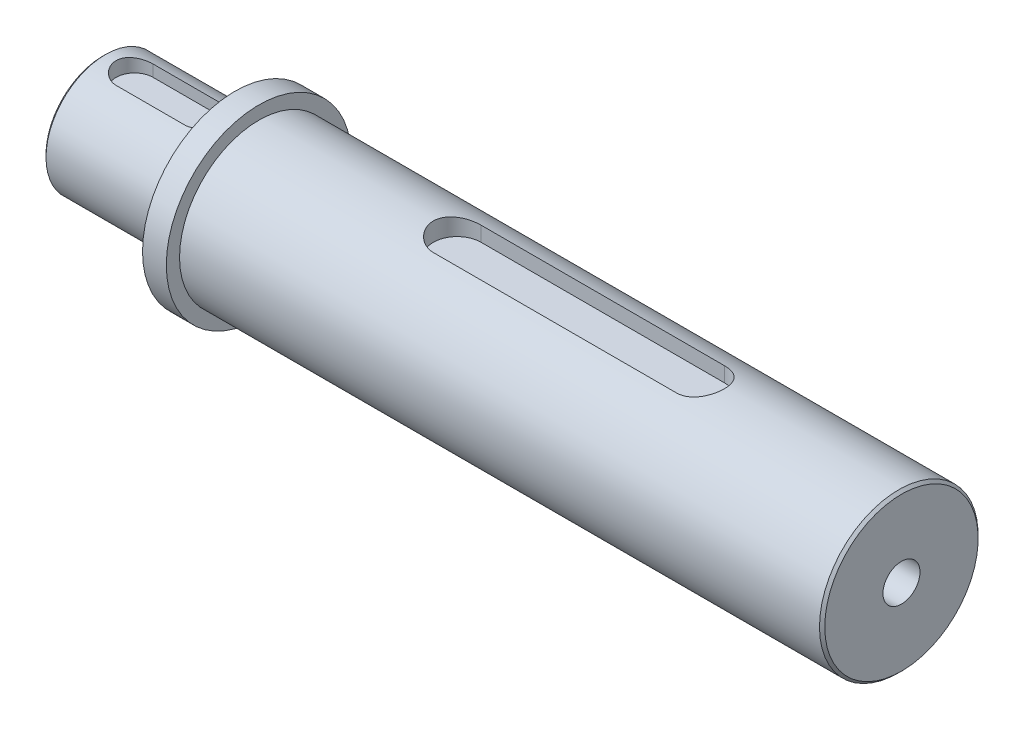
from build123d import *

# Parameters (mm, degrees)
CHAMFER_1_SIZE         = 1
HOLE_WIZARD_M161_D     = 14
HOLE_WIZARD_M161_DEPTH = 40.793975667
HOLE_WIZARD_M161_TIP   = 4.206024333
CUT_EXTRUDE_1_DEPTH    = 7
CUT_EXTRUDE_2_DEPTH    = 5.5


with BuildPart() as part:
    # Эскиз1 → Повернуть1 (revolve)
    with BuildSketch(Plane.XY, mode=Mode.PRIVATE) as revolve_1_sk:
        Polygon((-59, 0), (-59, 22.5), (-9, 22.5), (-9, 35), (0, 35), (0, 30), (243, 30), (243, 0), align=None)
    revolve(revolve_1_sk.sketch.rotate(Axis((-233.488372093, 0, 0), (1, 0, 0)), 90), axis=Axis((-233.488372093, 0, 0), (1, 0, 0)))

    # Фаска1
    chamfer_1_edges = [part.edges().sort_by_distance(p)[0] for p in [
        (243, 0, -30),
        (-59, 0, -22.5),
    ]]
    chamfer(chamfer_1_edges, length=CHAMFER_1_SIZE)

    # Отверстие обработанное метчиком M161
    with Locations(Plane(origin=(243, 0, 0), x_dir=(0, 0, -1), z_dir=(1, 0, 0))):
        with Locations((0, 0)):
            Hole(HOLE_WIZARD_M161_D / 2, depth=HOLE_WIZARD_M161_DEPTH)
            with Locations((0, 0, -(HOLE_WIZARD_M161_DEPTH + HOLE_WIZARD_M161_TIP / 2))):  # 118° drill point
                Cone(0, HOLE_WIZARD_M161_D / 2, HOLE_WIZARD_M161_TIP, mode=Mode.SUBTRACT)

    # Эскиз4 → Вырез-Вытянуть1 (cut)
    with BuildSketch(Plane(origin=(0, 30, 0), x_dir=(1, 0, 0), z_dir=(0, 1, 0))):
        with BuildLine():
            Line((167, -9), (75, -9))
            ThreePointArc((75, -9), (66, 0), (75, 9))
            Line((75, 9), (167, 9))
            ThreePointArc((167, 9), (176, 0), (167, -9))
        make_face()
    extrude(amount=-CUT_EXTRUDE_1_DEPTH, mode=Mode.SUBTRACT)

    # Эскиз5 → Вырез-Вытянуть2 (cut)
    with BuildSketch(Plane(origin=(0, 22.5, 0), x_dir=(1, 0, 0), z_dir=(0, 1, 0))):
        with BuildLine():
            Line((-47, 7), (-21, 7))
            ThreePointArc((-21, 7), (-14, 0), (-21, -7))
            Line((-21, -7), (-47, -7))
            ThreePointArc((-47, -7), (-54, 0), (-47, 7))
        make_face()
    extrude(amount=-CUT_EXTRUDE_2_DEPTH, mode=Mode.SUBTRACT)


solid = part.part
